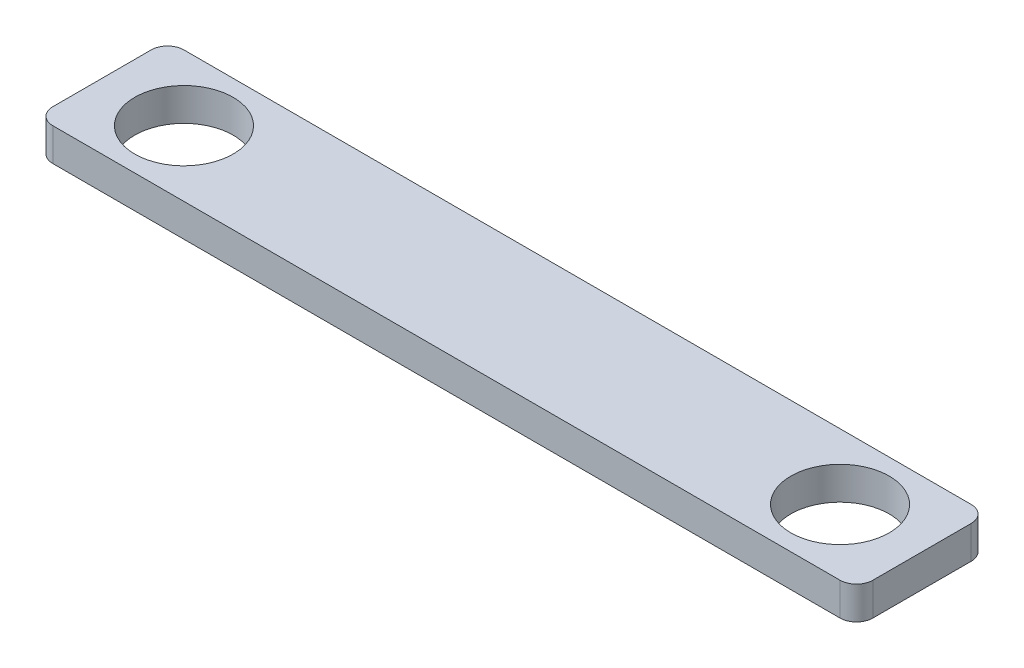
from build123d import *

# Parameters (mm, degrees)
SKETCH1_R           = 7.62
BOSS_EXTRUDE1_DEPTH = 5.08


with BuildPart() as part:
    # Sketch1 → Boss-Extrude1 (new body)
    with BuildSketch(Plane(origin=(0, 0, 0), x_dir=(1, 0, 0), z_dir=(0, 1, 0))):
        with BuildLine():
            Line((60.96, -10.16), (-60.96, -10.16))
            ThreePointArc((-60.96, -10.16), (-62.756051224, -9.416051224), (-63.5, -7.62))
            Line((-63.5, -7.62), (-63.5, 7.62))
            ThreePointArc((-63.5, 7.62), (-62.756051224, 9.416051224), (-60.96, 10.16))
            Line((-60.96, 10.16), (60.96, 10.16))
            ThreePointArc((60.96, 10.16), (62.756051224, 9.416051224), (63.5, 7.62))
            Line((63.5, 7.62), (63.5, -7.62))
            ThreePointArc((63.5, -7.62), (62.756051224, -9.416051224), (60.96, -10.16))
        make_face()
        with Locations(Location((-50.8, 0, 0), (0, 0, 270))):
            Circle(SKETCH1_R, mode=Mode.SUBTRACT)
        with Locations(Location((50.8, 0, 0), (0, 0, 270))):
            Circle(SKETCH1_R, mode=Mode.SUBTRACT)
    extrude(amount=BOSS_EXTRUDE1_DEPTH)


solid = part.part
